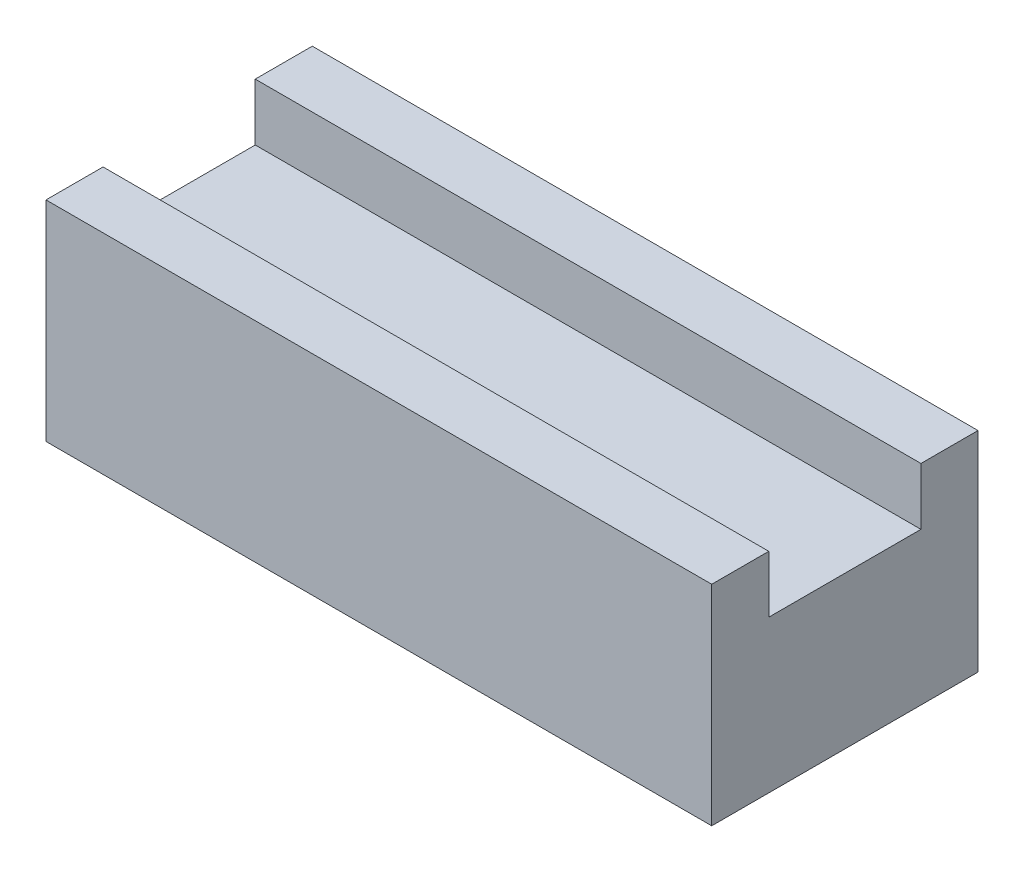
from build123d import *

# Parameters (mm, degrees)
BOSS_EXTRUDE1_DEPTH = 35


with BuildPart() as part:
    # Sketch1 → Boss-Extrude1 (new body)
    with BuildSketch(Plane(origin=(0, 0, 0), x_dir=(0, 0, -1), z_dir=(1, 0, 0))):
        Polygon((-7, 4), (-7, 7), (-4, 7), (-4, 4), (4, 4), (4, 7), (7, 7), (7, 4), (7, -4), (-7, -4), align=None)
    extrude(amount=-BOSS_EXTRUDE1_DEPTH)


solid = part.part
